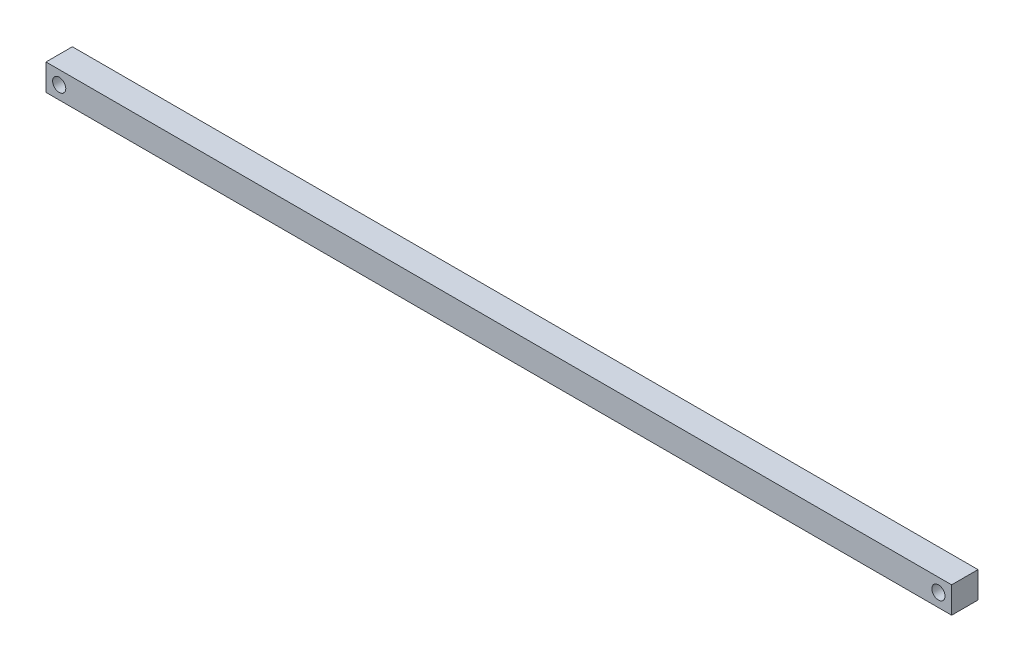
from build123d import *

# Parameters (mm, degrees)
SKETCH1_W           = 1030
SKETCH1_H           = 30
SKETCH1_R           = 7.5
BOSS_EXTRUDE1_DEPTH = 15


with BuildPart() as part:
    # Sketch1 → Boss-Extrude1 (new, symmetric)
    with BuildSketch(Plane.XY):
        Rectangle(SKETCH1_W, SKETCH1_H)
        with Locations((-500, 0)):
            Circle(SKETCH1_R, mode=Mode.SUBTRACT)
        with Locations((500, 0)):
            Circle(SKETCH1_R, mode=Mode.SUBTRACT)
    extrude(amount=BOSS_EXTRUDE1_DEPTH, both=True)


solid = part.part
